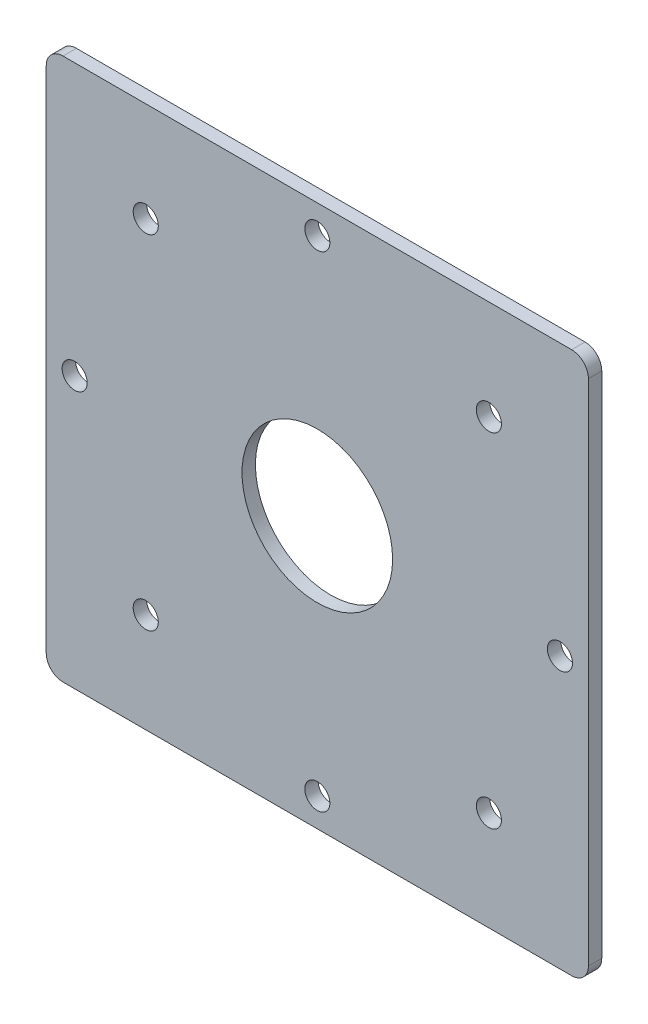
from build123d import *

# Parameters (mm, degrees)
SKETCH1_W           = 324
SKETCH1_H           = 324
BOSS_EXTRUDE1_DEPTH = 8
SKETCH2_R           = 7.5
CUT_EXTRUDE1_DEPTH  = 8
SKETCH3_R           = 45
CUT_EXTRUDE2_DEPTH  = 10
CIRPATTERN1_COUNT   = 8
FILLET1_R           = 10


with BuildPart() as part:
    # Sketch1 → Boss-Extrude1 (new body)
    with BuildSketch(Plane.XY):
        Rectangle(SKETCH1_W, SKETCH1_H)
    extrude(amount=BOSS_EXTRUDE1_DEPTH)

    # Sketch2 → Cut-Extrude1 (cut)
    with BuildSketch(Plane.XY.offset(8)):
        with Locations((0, 145)):
            Circle(SKETCH2_R)
    cut_extrude1 = extrude(amount=-CUT_EXTRUDE1_DEPTH, mode=Mode.SUBTRACT)

    # Sketch3 → Cut-Extrude2 (cut)
    with BuildSketch(Plane.XY.offset(8)):
        Circle(SKETCH3_R)
    extrude(amount=-CUT_EXTRUDE2_DEPTH, mode=Mode.SUBTRACT)

    # CirPattern1: Cut-Extrude1 ×8 about axis
    cirpattern1_axis = Axis((0, 0, 0), (0, 0, 1))
    for i in range(1, CIRPATTERN1_COUNT):
        add(cut_extrude1.rotate(cirpattern1_axis, i * 360 / CIRPATTERN1_COUNT), mode=Mode.SUBTRACT)

    # Fillet1
    fillet1_edges = [part.edges().sort_by_distance(p)[0] for p in [
        (162, -162, 4),
        (-162, -162, 4),
        (-162, 162, 4),
        (162, 162, 4),
    ]]
    fillet(fillet1_edges, radius=FILLET1_R)


solid = part.part
